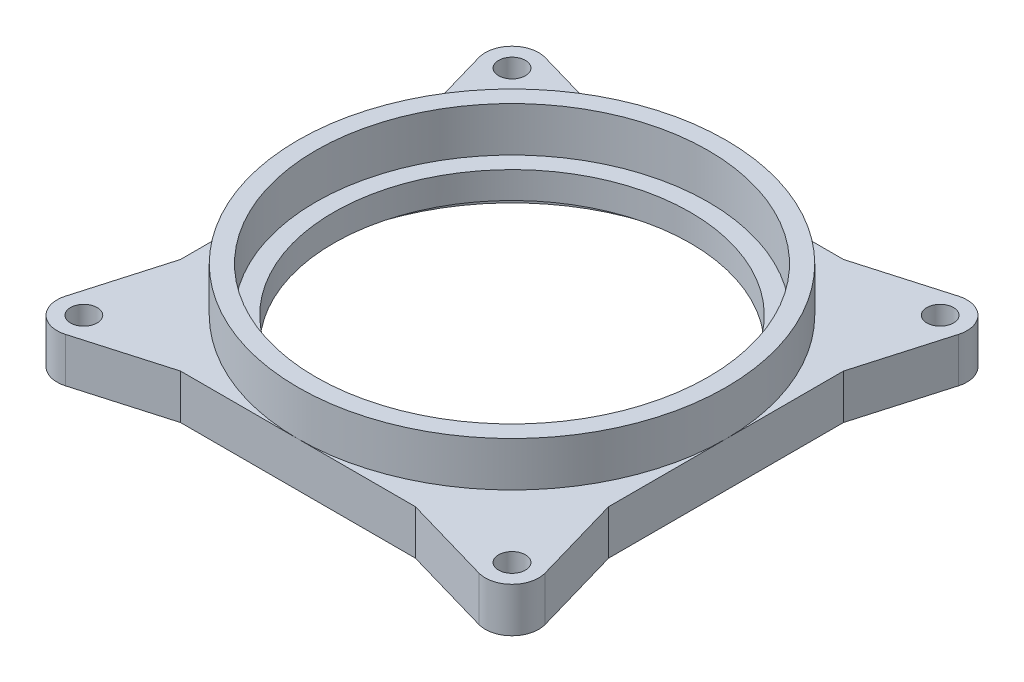
from build123d import *

# Parameters (mm, degrees)
SKETCH1_R           = 1.5
BOSS_EXTRUDE1_DEPTH = 25
SKETCH2_R           = 20
CUT_EXTRUDE1_DEPTH  = 23
CUT_EXTRUDE2_START  = -20
SKETCH3_R           = 1.5
CUT_EXTRUDE2_DEPTH  = 20
FILLET2_R           = 3
SKETCH4_R           = 22.5
SKETCH4_R_2         = 20
CUT_EXTRUDE3_DEPTH  = 2
CUT_EXTRUDE4_START  = -15
SKETCH5_R           = 24
CUT_EXTRUDE4_DEPTH  = 15
SKETCH6_R           = 22
CUT_EXTRUDE5_DEPTH  = 5


with BuildPart() as part:
    # Sketch1 → Boss-Extrude1 (new body)
    with BuildSketch(Plane(origin=(0, 0, 0), x_dir=(1, 0, 0), z_dir=(0, 1, 0))):
        with BuildLine():
            Line((13.169048105, 24), (-13.169048105, 24))
            Line((-13.169048105, 24), (-23.169048105, 26.882623622))
            ThreePointArc((-23.169048105, 26.882623622), (-26.121320344, 26.121320344), (-26.882623622, 23.169048105))
            Line((-26.882623622, 23.169048105), (-24, 13.169048105))
            Line((-24, 13.169048105), (-24, -13.169048105))
            Line((-24, -13.169048105), (-26.882623622, -23.169048105))
            ThreePointArc((-26.882623622, -23.169048105), (-26.121320344, -26.121320344), (-23.169048105, -26.882623622))
            Line((-23.169048105, -26.882623622), (-13.169048105, -24))
            Line((-13.169048105, -24), (13.169048105, -24))
            Line((13.169048105, -24), (23.169048105, -26.882623622))
            ThreePointArc((23.169048105, -26.882623622), (26.121320344, -26.121320344), (26.882623622, -23.169048105))
            Line((26.882623622, -23.169048105), (24, -13.169048105))
            Line((24, -13.169048105), (24, 13.169048105))
            Line((24, 13.169048105), (26.882623622, 23.169048105))
            ThreePointArc((26.882623622, 23.169048105), (26.121320344, 26.121320344), (23.169048105, 26.882623622))
            Line((23.169048105, 26.882623622), (13.169048105, 24))
        make_face()
        with Locations(Location((24, 24, 0), (0, 0, 270))):
            Circle(SKETCH1_R, mode=Mode.SUBTRACT)
        with Locations(Location((-24, -24, 0), (0, 0, 270))):
            Circle(SKETCH1_R, mode=Mode.SUBTRACT)
        with Locations(Location((24, -24, 0), (0, 0, 270))):
            Circle(SKETCH1_R, mode=Mode.SUBTRACT)
        with Locations(Location((-24, 24, 0), (0, 0, 270))):
            Circle(SKETCH1_R, mode=Mode.SUBTRACT)
    extrude(amount=BOSS_EXTRUDE1_DEPTH)

    # Sketch2 → Cut-Extrude1 (cut)
    with BuildSketch(Plane.XZ):
        with Locations(Location((0, 0, 0), (0, 0, 270))):
            Circle(SKETCH2_R)
    extrude(amount=-CUT_EXTRUDE1_DEPTH, mode=Mode.SUBTRACT)

    # Sketch3 → Cut-Extrude2 (cut)
    # profile 1 of 4: a face of its own
    with BuildSketch(Plane(origin=(0, 25, 0), x_dir=(1, 0, 0), z_dir=(0, 1, 0)).offset(CUT_EXTRUDE2_START)):
        with BuildLine():
            ThreePointArc((-24, 0), (-16.970562748, 16.970562748), (0, 24))
            Line((0, 24), (-13.169048105, 24))
            Line((-13.169048105, 24), (-23.169048105, 26.882623622))
            ThreePointArc((-23.169048105, 26.882623622), (-26.121320344, 26.121320344), (-26.882623622, 23.169048105))
            Line((-26.882623622, 23.169048105), (-24, 13.169048105))
            Line((-24, 13.169048105), (-24, 0))
        make_face()
        with Locations(Location((-24, 24, 0), (0, 0, 270))):
            Circle(SKETCH3_R, mode=Mode.SUBTRACT)
    # profile 2 of 4: a face of its own
    with BuildSketch(Plane(origin=(0, 25, 0), x_dir=(1, 0, 0), z_dir=(0, 1, 0)).offset(CUT_EXTRUDE2_START)):
        with BuildLine():
            Line((-13.169048105, -24), (0, -24))
            ThreePointArc((0, -24), (-16.970562748, -16.970562748), (-24, 0))
            Line((-24, 0), (-24, -13.169048105))
            Line((-24, -13.169048105), (-26.882623622, -23.169048105))
            ThreePointArc((-26.882623622, -23.169048105), (-26.121320344, -26.121320344), (-23.169048105, -26.882623622))
            Line((-23.169048105, -26.882623622), (-13.169048105, -24))
        make_face()
        with Locations(Location((-24, -24, 0), (0, 0, 270))):
            Circle(SKETCH3_R, mode=Mode.SUBTRACT)
    # profile 3 of 4: a face of its own
    with BuildSketch(Plane(origin=(0, 25, 0), x_dir=(1, 0, 0), z_dir=(0, 1, 0)).offset(CUT_EXTRUDE2_START)):
        with BuildLine():
            Line((24, -13.169048105), (24, 0))
            ThreePointArc((24, 0), (16.970562748, -16.970562748), (0, -24))
            Line((0, -24), (13.169048105, -24))
            Line((13.169048105, -24), (23.169048105, -26.882623622))
            ThreePointArc((23.169048105, -26.882623622), (26.121320344, -26.121320344), (26.882623622, -23.169048105))
            Line((26.882623622, -23.169048105), (24, -13.169048105))
        make_face()
        with Locations(Location((24, -24, 0), (0, 0, 270))):
            Circle(SKETCH3_R, mode=Mode.SUBTRACT)
    # profile 4 of 4: a face of its own
    with BuildSketch(Plane(origin=(0, 25, 0), x_dir=(1, 0, 0), z_dir=(0, 1, 0)).offset(CUT_EXTRUDE2_START)):
        with BuildLine():
            Line((24, 0), (24, 13.169048105))
            Line((24, 13.169048105), (26.882623622, 23.169048105))
            ThreePointArc((26.882623622, 23.169048105), (26.121320344, 26.121320344), (23.169048105, 26.882623622))
            Line((23.169048105, 26.882623622), (13.169048105, 24))
            Line((13.169048105, 24), (0, 24))
            ThreePointArc((0, 24), (16.970562748, 16.970562748), (24, 0))
        make_face()
        with Locations(Location((24, 24, 0), (0, 0, 270))):
            Circle(SKETCH3_R, mode=Mode.SUBTRACT)
    extrude(amount=CUT_EXTRUDE2_DEPTH, mode=Mode.SUBTRACT)

    # Fillet2
    fillet2_edges = [part.edges().sort_by_distance(p)[0] for p in [
        (0, 23, 20),
    ]]
    fillet(fillet2_edges, radius=FILLET2_R)

    # Sketch4 → Cut-Extrude3 (cut)
    with BuildSketch(Plane.XZ):
        with Locations(Location((0, 0, 0), (0, 0, 270))):
            Circle(SKETCH4_R)
        with Locations(Location((0, 0, 0), (0, 0, 270))):
            Circle(SKETCH4_R_2, mode=Mode.SUBTRACT)
    extrude(amount=-CUT_EXTRUDE3_DEPTH, mode=Mode.SUBTRACT)

    # Sketch5 → Cut-Extrude4 (cut)
    with BuildSketch(Plane(origin=(0, 25, 0), x_dir=(1, 0, 0), z_dir=(0, 1, 0)).offset(CUT_EXTRUDE4_START)):
        with Locations(Location((0, 0, 0), (0, 0, 270))):
            Circle(SKETCH5_R)
    extrude(amount=CUT_EXTRUDE4_DEPTH, mode=Mode.SUBTRACT)

    # Sketch6 → Cut-Extrude5 (cut)
    with BuildSketch(Plane(origin=(0, 10, 0), x_dir=(1, 0, 0), z_dir=(0, 1, 0))):
        with Locations(Location((0, 0, 0), (0, 0, 270))):
            Circle(SKETCH6_R)
    extrude(amount=-CUT_EXTRUDE5_DEPTH, mode=Mode.SUBTRACT)


solid = part.part
